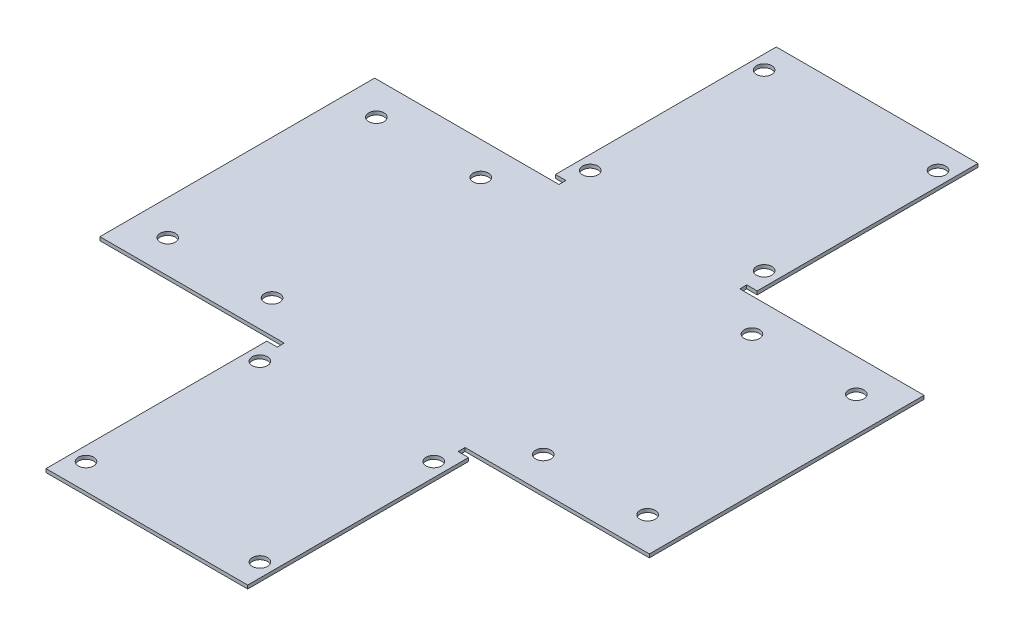
from build123d import *

# Parameters (mm, degrees)
SKETCH1_R           = 2.2
BOSS_EXTRUDE1_DEPTH = 1


with BuildPart() as part:
    # Sketch1 → Boss-Extrude1 (new body)
    with BuildSketch(Plane(origin=(0, 0, 0), x_dir=(1, 0, 0), z_dir=(0, 1, 0))):
        Polygon((0, -39.5), (3, -39.5), (3, -41.5), (0, -41.5), (0, -105), (58, -105), (58, -41.5), (55, -41.5), (55, -39.5), (58, -39.5), (108, -39.5), (108, 39.5), (58, 39.5), (55, 39.5), (55, 41.5), (58, 41.5), (58, 105), (0, 105), (0, 41.5), (3, 41.5), (3, 39.5), (0, 39.5), (-50, 39.5), (-50, -39.5), align=None)
        with Locations(Location((4, 97.5, 0), (0, 0, 270))):
            Circle(SKETCH1_R, mode=Mode.SUBTRACT)
        with Locations(Location((54, 97.5, 0), (0, 0, 270))):
            Circle(SKETCH1_R, mode=Mode.SUBTRACT)
        with Locations(Location((54, 47.5, 0), (0, 0, 270))):
            Circle(SKETCH1_R, mode=Mode.SUBTRACT)
        with Locations(Location((4, 47.5, 0), (0, 0, 270))):
            Circle(SKETCH1_R, mode=Mode.SUBTRACT)
        with Locations(Location((4, -47.5, 0), (0, 0, 270))):
            Circle(SKETCH1_R, mode=Mode.SUBTRACT)
        with Locations(Location((54, -47.5, 0), (0, 0, 270))):
            Circle(SKETCH1_R, mode=Mode.SUBTRACT)
        with Locations(Location((54, -97.5, 0), (0, 0, 270))):
            Circle(SKETCH1_R, mode=Mode.SUBTRACT)
        with Locations(Location((4, -97.5, 0), (0, 0, 270))):
            Circle(SKETCH1_R, mode=Mode.SUBTRACT)
        with Locations(Location((-40, 30, 0), (0, 0, 270))):
            Circle(SKETCH1_R, mode=Mode.SUBTRACT)
        with Locations(Location((-10, 30, 0), (0, 0, 270))):
            Circle(SKETCH1_R, mode=Mode.SUBTRACT)
        with Locations(Location((-40, -30, 0), (0, 0, 270))):
            Circle(SKETCH1_R, mode=Mode.SUBTRACT)
        with Locations(Location((-10, -30, 0), (0, 0, 270))):
            Circle(SKETCH1_R, mode=Mode.SUBTRACT)
        with Locations(Location((68, -30, 0), (0, 0, 270))):
            Circle(SKETCH1_R, mode=Mode.SUBTRACT)
        with Locations(Location((98, -30, 0), (0, 0, 270))):
            Circle(SKETCH1_R, mode=Mode.SUBTRACT)
        with Locations(Location((98, 30, 0), (0, 0, 270))):
            Circle(SKETCH1_R, mode=Mode.SUBTRACT)
        with Locations(Location((68, 30, 0), (0, 0, 270))):
            Circle(SKETCH1_R, mode=Mode.SUBTRACT)
    extrude(amount=BOSS_EXTRUDE1_DEPTH)


solid = part.part
